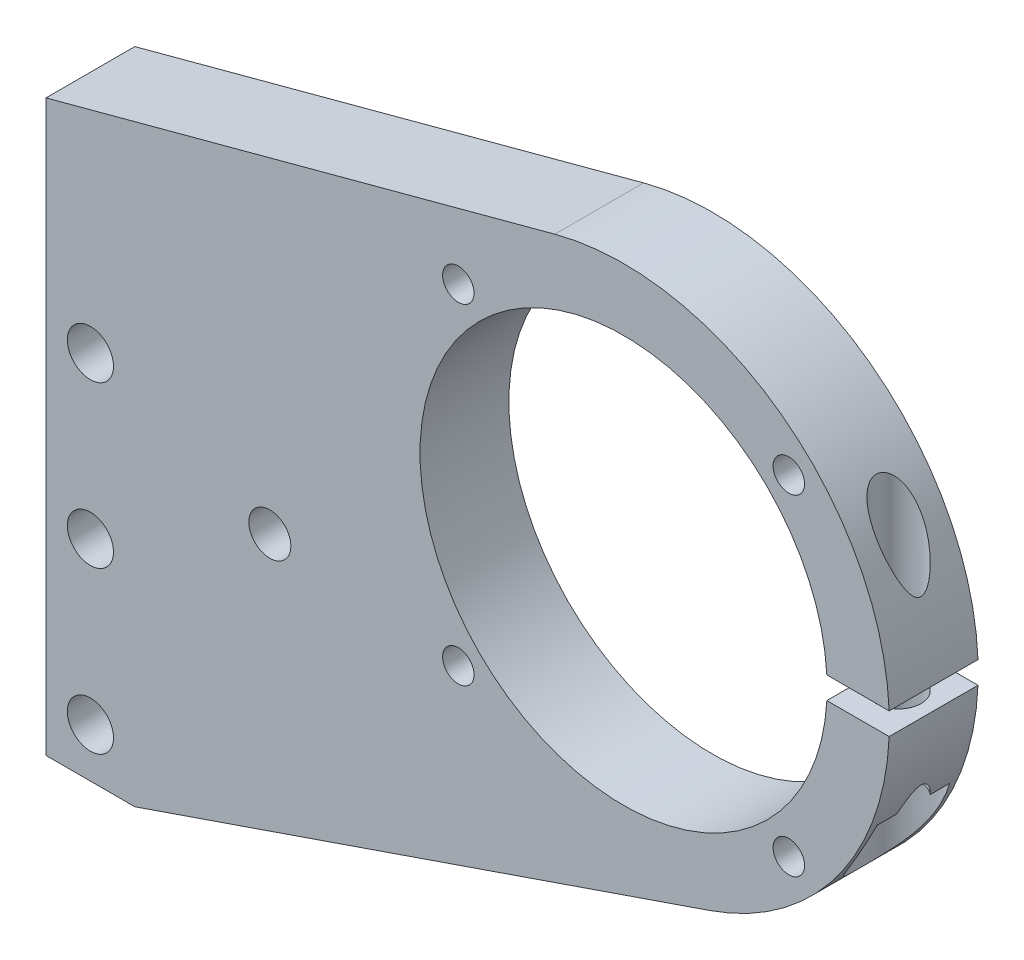
from build123d import *

# Parameters (mm, degrees)
BOSS_EXTRUDE1_DEPTH     = 12.7
CUT_EXTRUDE1_DEPTH      = 270.19769127
SKETCH3_W               = 29.1
SKETCH3_H               = 12.7
F_12_CLEARANCE_HOLE1_D  = 6
F_8_CLEARANCE_HOLE1_D   = 4.5
F_1_4_CLEARANCE_HOLE1_D = 6.6
SKETCH10_W              = 2.5
SKETCH10_H              = 36.4125
HOLE1_D                 = 6.4
HOLE1_DEPTH             = 64.36393101
HOLE1_CBORE_D           = 11.2
HOLE1_CBORE_DEPTH       = 11.77643101
CHAMFER1_SIZE           = 3


with BuildPart() as part:
    # Sketch1 → Boss-Extrude1 (new body)
    with BuildSketch(Plane(origin=(0, 0, 0), x_dir=(-1, 0, 0), z_dir=(0, 0, -1))):
        with BuildLine():
            Line((129.246532787, 74.570537656), (211.469455465, 46.304993078))
            Line((211.469455465, 46.304993078), (224.169455465, 46.304993078))
            Line((224.169455465, 46.304993078), (224.169455465, 127.72254562))
            Line((224.169455465, 127.72254562), (151.435240745, 147.211619716))
            ThreePointArc((151.435240745, 147.211619716), (105.257753851, 121.607458019), (129.246532787, 74.570537656))
        make_face()
    extrude(amount=-BOSS_EXTRUDE1_DEPTH)

    # Sketch2 → Cut-Extrude1 (cut, through all)
    with BuildSketch(Plane.XY.offset(12.7)):
        with BuildLine():
            Line((-103.633291463, 112.093938317), (-113.069248332, 112.093938317))
            ThreePointArc((-113.069248332, 112.093938317), (-113.025117032, 110.506438317), (-113.069248332, 108.918938317))
            Line((-113.069248332, 108.918938317), (-103.633291463, 108.918938317))
            ThreePointArc((-103.633291463, 108.918938317), (-103.600117032, 110.506438317), (-103.633291463, 112.093938317))
        make_face()
    extrude(amount=-CUT_EXTRUDE1_DEPTH, mode=Mode.SUBTRACT)

    # Sketch3 → Cut-Revolve1 (revolve, cut)
    with BuildSketch(Plane.XZ.offset(-110.506438317)):
        with Locations((-127.050117032, 6.35)):
            Rectangle(SKETCH3_W, SKETCH3_H)
    revolve(axis=Axis((-141.600117032, 110.506438317, 12.7), (0, 0, -1)), mode=Mode.SUBTRACT)

    # #12 Clearance Hole1 (through all)
    with Locations(Plane.XY.offset(12.7)):
        with Locations((-192.169455465, 89.72254562)):
            Hole(F_12_CLEARANCE_HOLE1_D / 2)

    # #8 Clearance Hole1 (through all)
    with Locations(Plane.XY.offset(12.7)):
        with Locations((-117.978117032, 86.884438317), (-165.222117032, 86.884438317), (-165.222117032, 134.128438317), (-117.978117032, 134.128438317)):
            Hole(F_8_CLEARANCE_HOLE1_D / 2)

    # 1/4 Clearance Hole1 (through all)
    with Locations(Plane(origin=(0, 0, 0), x_dir=(-1, 0, 0), z_dir=(0, 0, -1))):
        with Locations((217.819455465, 53.304993078), (217.819455465, 76.304993078), (217.819455465, 99.304993078)):
            Hole(F_1_4_CLEARANCE_HOLE1_D / 2)

    # Sketch10 → #10 Clearance Hole1 (revolve, cut)
    with BuildSketch(Plane(origin=(-108.633291463, 112.093938317, 6.35), x_dir=(0, 0, -1), z_dir=(1, 0, 0))):
        with Locations((1.25, 18.20625)):
            Rectangle(SKETCH10_W, SKETCH10_H)
    revolve(axis=Axis((-108.633291463, 105.743938317, 6.35), (0, 1, 0)), mode=Mode.SUBTRACT)

    # Hole1
    with Locations(Plane(origin=(0, 84.142507307, 0), x_dir=(-1, 0, 0), z_dir=(0, -1, 0))):
        with Locations((108.633291463, -6.35)):
            CounterBoreHole(HOLE1_D / 2, HOLE1_CBORE_D / 2, HOLE1_CBORE_DEPTH, depth=HOLE1_DEPTH)

    # Chamfer1
    chamfer1_edges = [part.edges().sort_by_distance(p)[0] for p in [
        (-221.119455465, 99.304993078, 0),
        (-221.119455465, 76.304993078, 0),
        (-221.119455465, 53.304993078, 0),
    ]]
    chamfer(chamfer1_edges, length=CHAMFER1_SIZE)


solid = part.part
